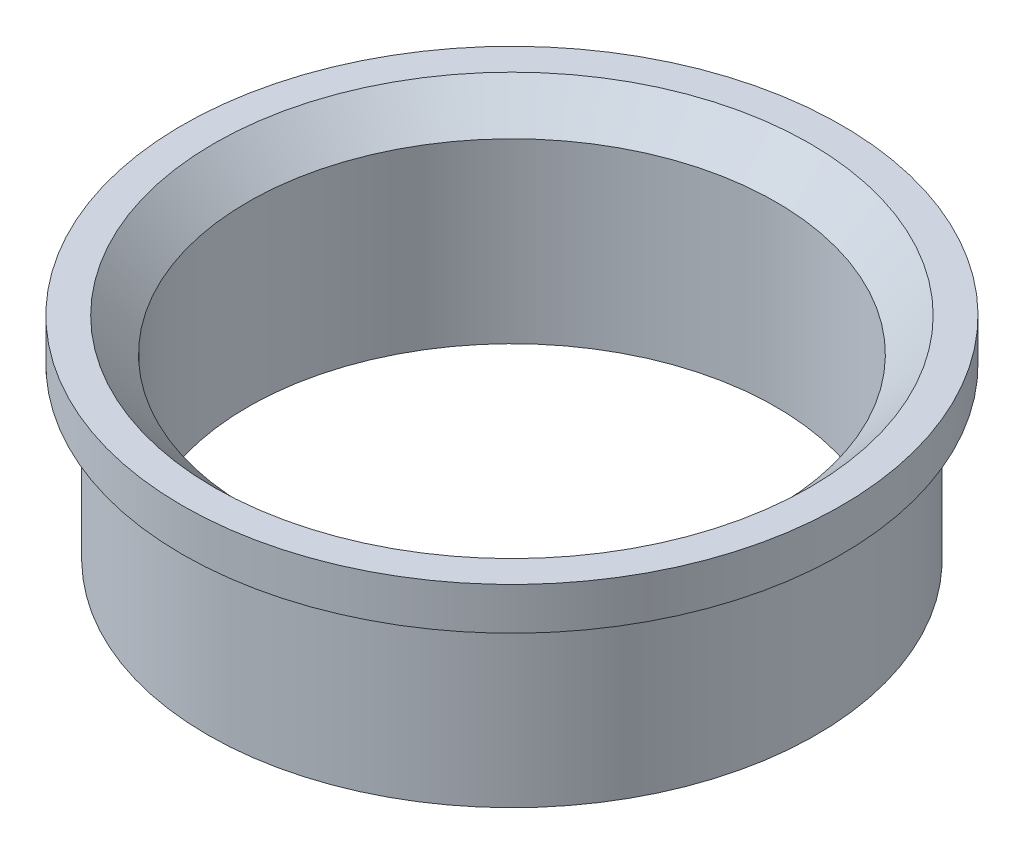
from build123d import *


with BuildPart() as part:
    # Sketch2 → Revolve1 (revolve)
    with BuildSketch(Plane.XY, mode=Mode.PRIVATE) as revolve1_sk:
        Polygon((62.5, 0), (62.5, 42), (70.5, 50), (78, 50), (78, 40), (72, 40), (72, 0), align=None)
    revolve(revolve1_sk.sketch.rotate(Axis((0, 72.788119525, 0), (0, -1, 0)), 90), axis=Axis((0, 72.788119525, 0), (0, -1, 0)))


solid = part.part
